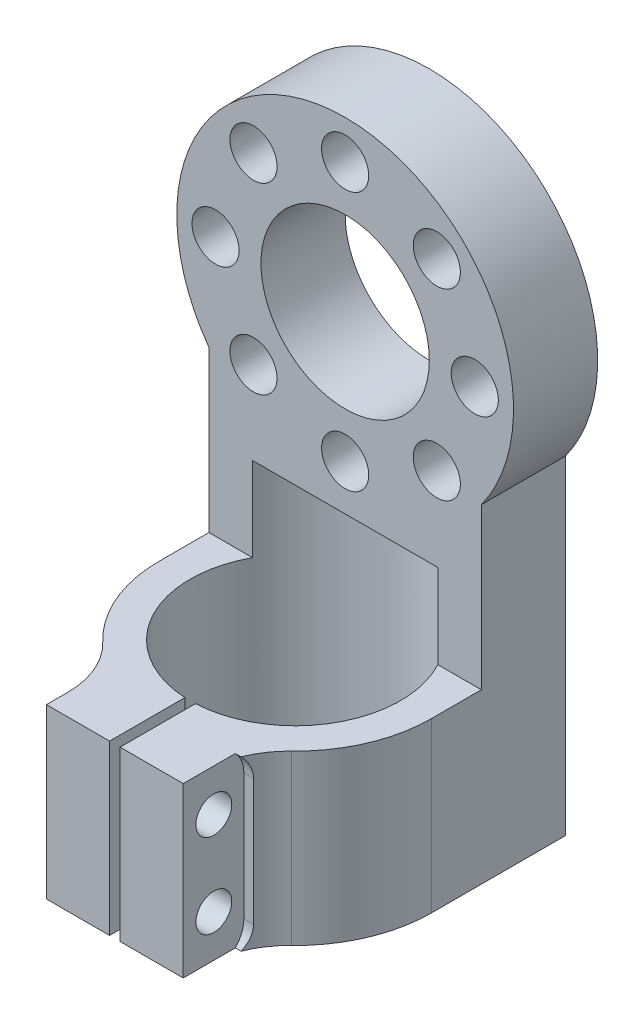
from build123d import *

# Parameters (mm, degrees)
ESQUISSE1_R                  = 6.35
ESQUISSE1_R_2                = 1.778
BOSS_EXTRU_1_DEPTH           = 6.35
BOSS_EXTRU_2_DEPTH           = 12.7
ENL_V_MAT_EXTRU_1_DEPTH      = 19.05
CONG_1_R                     = 6.35
ENL_V_MAT_EXTRU_2_REACH      = 45.845
ENL_V_MAT_EXTRU_2_END_RADIUS = 6.35
ESQUISSE5_R                  = 1.35255
ENL_V_MAT_EXTRU_3_DEPTH      = 44.844555452


with BuildPart() as part:
    # Esquisse1 → Boss.-Extru.1 (new body)
    with BuildSketch(Plane.XY):
        with BuildLine():
            Line((-10.2743, -7.465169758), (-10.2743, -32.258))
            Line((-10.2743, -32.258), (10.2743, -32.258))
            Line((10.2743, -32.258), (10.2743, -7.465169758))
            ThreePointArc((10.2743, -7.465169758), (0, 12.7), (-10.2743, -7.465169758))
        make_face()
        Circle(ESQUISSE1_R, mode=Mode.SUBTRACT)
        with Locations((0, 9.779)):
            Circle(ESQUISSE1_R_2, mode=Mode.SUBTRACT)
        with Locations((6.914797213, 6.914797213)):
            Circle(ESQUISSE1_R_2, mode=Mode.SUBTRACT)
        with Locations((9.779, 0)):
            Circle(ESQUISSE1_R_2, mode=Mode.SUBTRACT)
        with Locations((6.914797213, -6.914797213)):
            Circle(ESQUISSE1_R_2, mode=Mode.SUBTRACT)
        with Locations((0, -9.779)):
            Circle(ESQUISSE1_R_2, mode=Mode.SUBTRACT)
        with Locations((-6.914797213, -6.914797213)):
            Circle(ESQUISSE1_R_2, mode=Mode.SUBTRACT)
        with Locations((-9.779, 0)):
            Circle(ESQUISSE1_R_2, mode=Mode.SUBTRACT)
        with Locations((-6.914797213, 6.914797213)):
            Circle(ESQUISSE1_R_2, mode=Mode.SUBTRACT)
    extrude(amount=BOSS_EXTRU_1_DEPTH)

    # Esquisse2 → Boss.-Extru.2 (add)
    with BuildSketch(Plane.XZ.offset(32.258)):
        with BuildLine():
            Line((-10.2743, 10.1092), (-10.2743, 6.35))
            Line((-10.2743, 6.35), (10.2743, 6.35))
            Line((10.2743, 6.35), (10.2743, 10.1092))
            ThreePointArc((10.2743, 10.1092), (8.9042183, 15.235225455), (5.159375, 18.994136134))
            Line((5.159375, 18.994136134), (5.159375, 23.7236))
            Line((5.159375, 23.7236), (-5.159375, 23.7236))
            Line((-5.159375, 23.7236), (-5.159375, 18.994136134))
            ThreePointArc((-5.159375, 18.994136134), (-8.9042183, 15.235225455), (-10.2743, 10.1092))
        make_face()
    extrude(amount=-BOSS_EXTRU_2_DEPTH)

    # Esquisse3 → Enlèv. mat.-Extru.1 (cut)
    with BuildSketch(Plane.XZ.offset(32.258)):
        with BuildLine():
            Line((-0.396875, 18.036771916), (-0.396875, 23.7236))
            Line((-0.396875, 23.7236), (0.396875, 23.7236))
            Line((0.396875, 23.7236), (0.396875, 18.036771916))
            ThreePointArc((0.396875, 18.036771916), (0, 2.1717), (-0.396875, 18.036771916))
        make_face()
    extrude(amount=-ENL_V_MAT_EXTRU_1_DEPTH, mode=Mode.SUBTRACT)

    # Congé1
    cong_1_edges = [part.edges().sort_by_distance(p)[0] for p in [
        (-5.159375, -25.908, 18.994136134),
        (5.159375, -25.908, 18.994136134),
    ]]
    fillet(cong_1_edges, radius=CONG_1_R)

    # Enlèv. mat.-Extru.2: up to this cylinder (the profile starts outside it)
    enl_v_mat_extru_2_end = Plane(origin=(11.509375, -25.908, 22.105100867), z_dir=(0, -1, 0)) * Cylinder(ENL_V_MAT_EXTRU_2_END_RADIUS, 105.39, mode=Mode.PRIVATE)
    # Esquisse4 → Enlèv. mat.-Extru.2 (cut, up to the surface)
    with BuildSketch(Plane(origin=(5.159375, 0, 0), x_dir=(0, 0, -1), z_dir=(1, 0, 0)), mode=Mode.PRIVATE) as enl_v_mat_extru_2_sk1:
        with BuildLine():
            Line((-19.1516, -21.1455), (-19.1516, -30.6705))
            ThreePointArc((-19.1516, -30.6705), (-21.4376, -32.9565), (-23.7236, -30.6705))
            Line((-23.7236, -30.6705), (-23.7236, -21.1455))
            ThreePointArc((-23.7236, -21.1455), (-21.4376, -18.8595), (-19.1516, -21.1455))
        make_face()
    enl_v_mat_extru_2_tool1 = extrude(enl_v_mat_extru_2_sk1.sketch, amount=ENL_V_MAT_EXTRU_2_REACH, mode=Mode.PRIVATE) - enl_v_mat_extru_2_end
    add(enl_v_mat_extru_2_tool1.solids().sort_by_distance((5.159375, -25.908, 21.4376))[0], mode=Mode.SUBTRACT)
    add(enl_v_mat_extru_2_tool1.solids().sort_by_distance((5.159375, -25.908, 21.4376))[1], mode=Mode.SUBTRACT)

    # Esquisse5 → Enlèv. mat.-Extru.3 (cut, through all)
    with BuildSketch(Plane(origin=(5.159375, 0, 0), x_dir=(0, 0, -1), z_dir=(1, 0, 0))):
        with Locations(Location((-21.415375, -22.733, 0), (0, 0, 120.660154312))):
            Circle(ESQUISSE5_R)
        with Locations(Location((-21.415375, -29.083, 0), (0, 0, 239.339845688))):
            Circle(ESQUISSE5_R)
    extrude(amount=-ENL_V_MAT_EXTRU_3_DEPTH, mode=Mode.SUBTRACT)


solid = part.part
